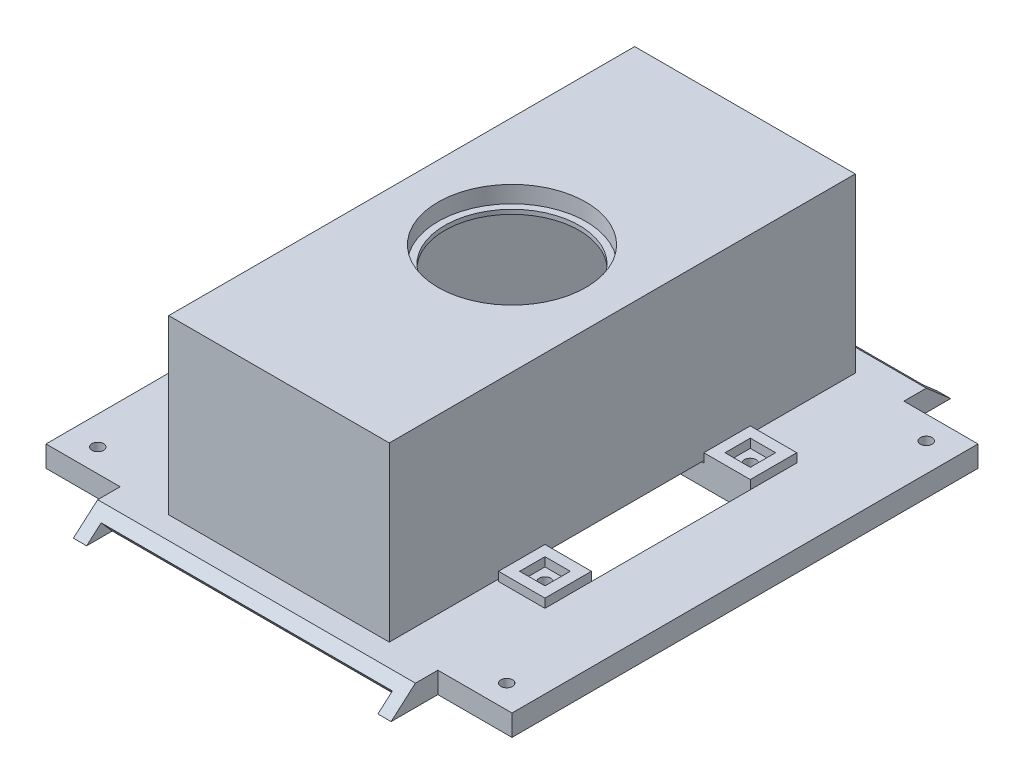
from build123d import *

# Parameters (mm, degrees)
SKETCH1_W           = 88
SKETCH1_H           = 88
BOSS_EXTRUDE1_DEPTH = 4
SKETCH2_W           = 41.655
SKETCH2_H           = 88
SKETCH2_W_2         = 33.655
SKETCH2_H_2         = 82.55
BOSS_EXTRUDE2_DEPTH = 28.575
SKETCH4_W           = 33.655
SKETCH4_H           = 82.55
CUT_EXTRUDE1_DEPTH  = 69.472845895
SKETCH5_W           = 41.655
SKETCH5_H           = 88
BOSS_EXTRUDE3_DEPTH = 4
SKETCH6_R           = 13.97
CUT_EXTRUDE2_DEPTH  = 3.175
SKETCH7_R           = 12.7
CUT_EXTRUDE3_DEPTH  = 71.622659253
SKETCH8_W           = 60
SKETCH8_H           = 30
CUT_EXTRUDE4_DEPTH  = 4
SKETCH9_W           = 8.7752
SKETCH9_H           = 8.7752
SKETCH9_W_2         = 4.7752
SKETCH9_H_2         = 4.7752
BOSS_EXTRUDE4_DEPTH = 5.6764
SKETCH10_R          = 1.1
CUT_EXTRUDE5_DEPTH  = 73.17846372
SKETCH11_R          = 1.1
CUT_EXTRUDE6_DEPTH  = 71.236248654
BOSS_EXTRUDE5_DEPTH = 30
CUT_EXTRUDE7_DEPTH  = 27.5


with BuildPart() as part:
    # Sketch1 → Boss-Extrude1 (new body)
    with BuildSketch(Plane(origin=(0, 0, 0), x_dir=(1, 0, 0), z_dir=(0, 1, 0))):
        Rectangle(SKETCH1_W, SKETCH1_H)
    extrude(amount=BOSS_EXTRUDE1_DEPTH)

    # Sketch2 → Boss-Extrude2 (add)
    with BuildSketch(Plane(origin=(0, 4, 0), x_dir=(1, 0, 0), z_dir=(0, 1, 0))):
        Rectangle(SKETCH2_W, SKETCH2_H)
        Rectangle(SKETCH2_W_2, SKETCH2_H_2, mode=Mode.SUBTRACT)
    extrude(amount=BOSS_EXTRUDE2_DEPTH)

    # Sketch4 → Cut-Extrude1 (cut, through all)
    with BuildSketch(Plane(origin=(0, 4, 0), x_dir=(1, 0, 0), z_dir=(0, 1, 0))):
        Rectangle(SKETCH4_W, SKETCH4_H)
    extrude(amount=-CUT_EXTRUDE1_DEPTH, mode=Mode.SUBTRACT)

    # Sketch5 → Boss-Extrude3 (add)
    with BuildSketch(Plane(origin=(0, 32.575, 0), x_dir=(1, 0, 0), z_dir=(0, 1, 0))):
        Rectangle(SKETCH5_W, SKETCH5_H)
    extrude(amount=BOSS_EXTRUDE3_DEPTH)

    # Sketch6 → Cut-Extrude2 (cut)
    with BuildSketch(Plane(origin=(0, 36.575, 0), x_dir=(1, 0, 0), z_dir=(0, 1, 0))):
        with Locations(Location((0, 0, 0), (0, 0, 270))):
            Circle(SKETCH6_R)
    extrude(amount=-CUT_EXTRUDE2_DEPTH, mode=Mode.SUBTRACT)

    # Sketch7 → Cut-Extrude3 (cut, through all)
    with BuildSketch(Plane(origin=(0, 33.4, 0), x_dir=(1, 0, 0), z_dir=(0, 1, 0))):
        with Locations(Location((0, 0, 0), (0, 0, 270))):
            Circle(SKETCH7_R)
    extrude(amount=-CUT_EXTRUDE3_DEPTH, mode=Mode.SUBTRACT)

    # Sketch8 → Cut-Extrude4 (cut)
    with BuildSketch(Plane.XZ):
        Rectangle(SKETCH8_W, SKETCH8_H)
    extrude(amount=-CUT_EXTRUDE4_DEPTH, mode=Mode.SUBTRACT)

    # Sketch9 → Boss-Extrude4 (add)
    # profile 1 of 4: a face of its own
    with BuildSketch(Plane.XZ):
        with Locations((-25.6124, 19.3876)):
            Rectangle(SKETCH9_W, SKETCH9_H)
        with Locations((-25.6124, 19.3876)):
            Rectangle(SKETCH9_W_2, SKETCH9_H_2, mode=Mode.SUBTRACT)
    # profile 2 of 4: a face of its own
    with BuildSketch(Plane.XZ):
        with Locations((25.6124, 19.3876)):
            Rectangle(SKETCH9_W, SKETCH9_H)
        with Locations((25.6124, 19.3876)):
            Rectangle(SKETCH9_W_2, SKETCH9_H_2, mode=Mode.SUBTRACT)
    # profile 3 of 4: a face of its own
    with BuildSketch(Plane.XZ):
        with Locations((25.6124, -19.3876)):
            Rectangle(SKETCH9_W, SKETCH9_H)
        with Locations((25.6124, -19.3876)):
            Rectangle(SKETCH9_W_2, SKETCH9_H_2, mode=Mode.SUBTRACT)
    # profile 4 of 4: a face of its own
    with BuildSketch(Plane.XZ):
        with Locations((-25.6124, -19.3876)):
            Rectangle(SKETCH9_W, SKETCH9_H)
        with Locations((-25.6124, -19.3876)):
            Rectangle(SKETCH9_W_2, SKETCH9_H_2, mode=Mode.SUBTRACT)
    extrude(amount=-BOSS_EXTRUDE4_DEPTH)

    # Sketch10 → Cut-Extrude5 (cut, through all)
    with BuildSketch(Plane.XZ):
        with Locations(Location((-25.6124, 19.3876, 0), (0, 0, 270))):
            Circle(SKETCH10_R)
        with Locations(Location((25.6124, 19.3876, 0), (0, 0, 270))):
            Circle(SKETCH10_R)
        with Locations(Location((25.6124, -19.3876, 0), (0, 0, 270))):
            Circle(SKETCH10_R)
        with Locations(Location((-25.6124, -19.3876, 0), (0, 0, 270))):
            Circle(SKETCH10_R)
    extrude(amount=-CUT_EXTRUDE5_DEPTH, mode=Mode.SUBTRACT)

    # Sketch11 → Cut-Extrude6 (cut, through all)
    with BuildSketch(Plane(origin=(0, 4, 0), x_dir=(1, 0, 0), z_dir=(0, 1, 0))):
        with Locations(Location((-38.6124, 39.6124, 0), (0, 0, 270))):
            Circle(SKETCH11_R)
        with Locations(Location((38.6124, 39.6124, 0), (0, 0, 90))):
            Circle(SKETCH11_R)
        with Locations(Location((38.6124, -39.6124, 0), (0, 0, 270))):
            Circle(SKETCH11_R)
        with Locations(Location((-38.6124, -39.6124, 0), (0, 0, 90))):
            Circle(SKETCH11_R)
    extrude(amount=-CUT_EXTRUDE6_DEPTH, mode=Mode.SUBTRACT)

    # Sketch14 → Boss-Extrude5 (add, symmetric)
    with BuildSketch(Plane(origin=(0, 0, 0), x_dir=(0, 0, -1), z_dir=(1, 0, 0))):
        Polygon((-44, 4), (-48.238152403, 4), (-52.828513848, 0), (-44, 0), align=None)
        Polygon((44, 0), (44, 4), (48.238152403, 4), (52.828513848, 0), align=None)
    extrude(amount=BOSS_EXTRUDE5_DEPTH, both=True)

    # Sketch15 → Cut-Extrude7 (cut, symmetric)
    with BuildSketch(Plane(origin=(0, 0, 0), x_dir=(0, 0, -1), z_dir=(1, 0, 0))):
        Polygon((-50.081518623, 2.393707125), (-47.995663595, 0), (-50.74265882, -2.393707125), (-52.828513848, 0), align=None)
        Polygon((52.828513848, 0), (50.081518623, 2.393707125), (47.995663595, 0), (50.74265882, -2.393707125), align=None)
    extrude(amount=CUT_EXTRUDE7_DEPTH, both=True, mode=Mode.SUBTRACT)


solid = part.part
